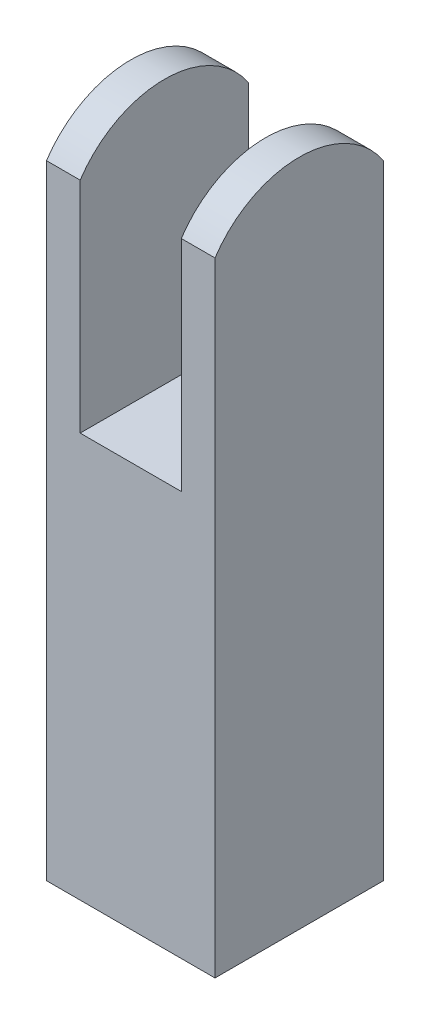
from build123d import *

# Parameters (mm, degrees)
SKETCH1_W               = 50
SKETCH1_H               = 50
BOSS_EXTRUDE1_DEPTH     = 200
SKETCH4_W               = 30
SKETCH4_H               = 50
CUT_EXTRUDE1_DEPTH      = 80
CUT_EXTRUDE2_DEPTH      = 213.132034356
CUT_EXTRUDE2_DEPTH_BACK = 213.132034356


with BuildPart() as part:
    # Sketch1 → Boss-Extrude1 (new body)
    with BuildSketch(Plane(origin=(0, 0, 0), x_dir=(1, 0, 0), z_dir=(0, 1, 0))):
        with Locations((-25, 25)):
            Rectangle(SKETCH1_W, SKETCH1_H)
    extrude(amount=BOSS_EXTRUDE1_DEPTH)

    # Sketch4 → Cut-Extrude1 (cut)
    with BuildSketch(Plane(origin=(0, 200, 0), x_dir=(1, 0, 0), z_dir=(0, 1, 0))):
        with Locations((-25, 25)):
            Rectangle(SKETCH4_W, SKETCH4_H)
    extrude(amount=-CUT_EXTRUDE1_DEPTH, mode=Mode.SUBTRACT)

    # Sketch5 → Cut-Extrude2 (cut, two sides: drawn at the far end of the back side and taken through both)
    with BuildSketch(Plane(origin=(0, 0, 0), x_dir=(0, 0, -1), z_dir=(1, 0, 0)).offset(-CUT_EXTRUDE2_DEPTH_BACK)):
        with BuildLine():
            Line((-217.391133594, -142.729464946), (0, 185))
            ThreePointArc((0, 185), (25, 198.416876048), (50, 185))
            Line((50, 185), (267.391133594, -142.729464946))
            Line((267.391133594, -142.729464946), (267.391133594, 643.821250924))
            Line((267.391133594, 643.821250924), (-217.391133594, 643.821250924))
            Line((-217.391133594, 643.821250924), (-217.391133594, -142.729464946))
        make_face()
    extrude(amount=CUT_EXTRUDE2_DEPTH + CUT_EXTRUDE2_DEPTH_BACK, mode=Mode.SUBTRACT)


solid = part.part
